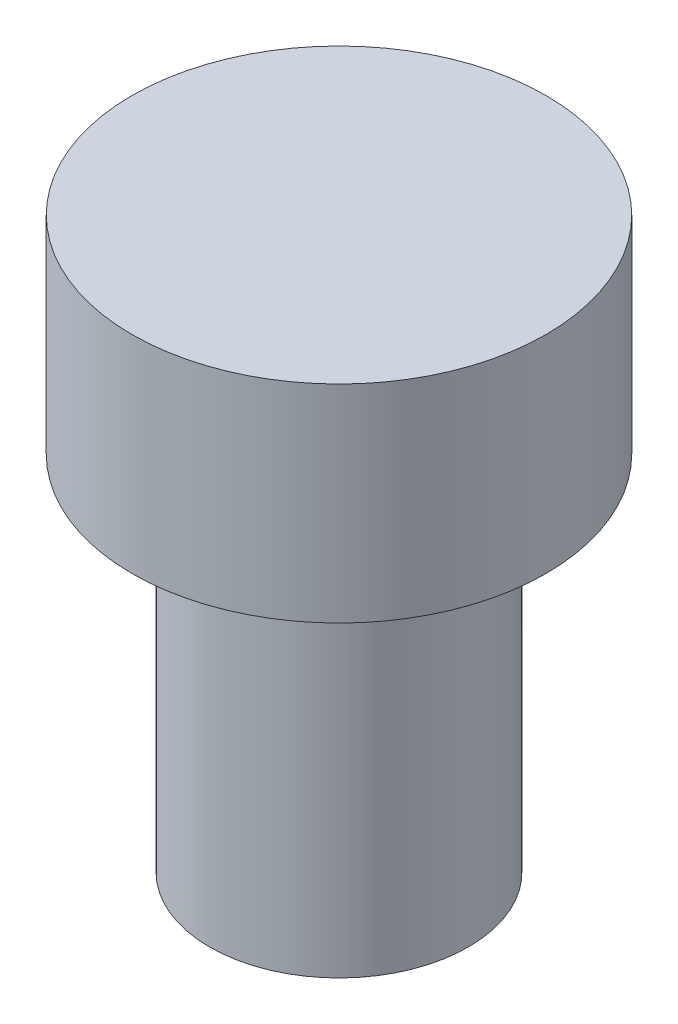
from build123d import *

# Parameters (mm, degrees)
SKETCH1_R           = 2.5
BOSS_EXTRUDE1_DEPTH = 7
SKETCH2_R           = 4
BOSS_EXTRUDE2_DEPTH = 4


with BuildPart() as part:
    # Sketch1 → Boss-Extrude1 (new body)
    with BuildSketch(Plane(origin=(0, 0, 0), x_dir=(1, 0, 0), z_dir=(0, 1, 0))):
        with Locations(Location((0, 0, 0), (0, 0, 270))):
            Circle(SKETCH1_R)
    extrude(amount=BOSS_EXTRUDE1_DEPTH)

    # Sketch2 → Boss-Extrude2 (add)
    with BuildSketch(Plane(origin=(0, 7, 0), x_dir=(1, 0, 0), z_dir=(0, 1, 0))):
        with Locations(Location((0, 0, 0), (0, 0, 270))):
            Circle(SKETCH2_R)
    extrude(amount=BOSS_EXTRUDE2_DEPTH)


solid = part.part
